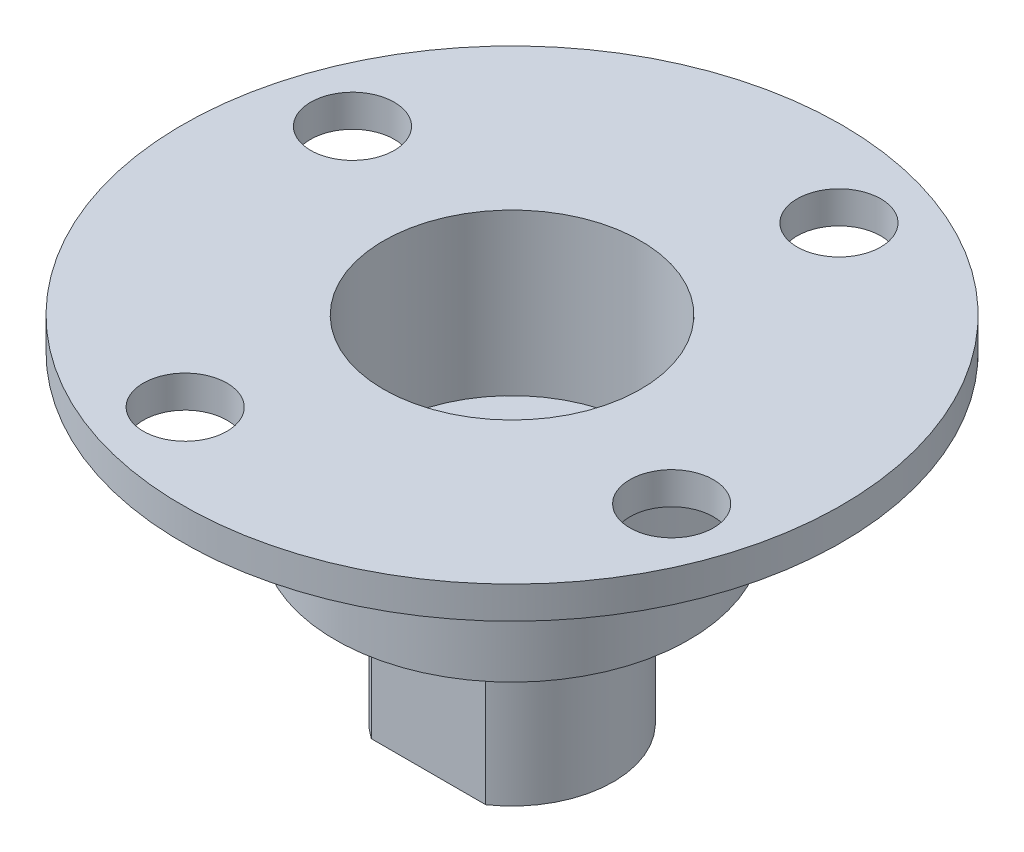
from build123d import *

# Parameters (mm, degrees)
ESQUISSE1_R                  = 10.25
BOSS_EXTRU_1_DEPTH           = 1
D_GAGEMENT_M21_D             = 2.6
R_P_TITION_CIRCULAIRE1_COUNT = 4
ESQUISSE9_R                  = 5.5
BOSS_EXTRU_4_DEPTH           = 5
CONG_1_R                     = 0.5
ESQUISSE11_R                 = 4
ENL_V_MAT_EXTRU_2_DEPTH      = 5
BOSS_EXTRU_5_DEPTH           = 5


with BuildPart() as part:
    # Esquisse1 → Boss.-Extru.1 (new body)
    with BuildSketch(Plane.XZ.offset(38.601290575)):
        with Locations(Location((14.017249305, 17.25, 0), (0, 0, 270))):
            Circle(ESQUISSE1_R)
    extrude(amount=BOSS_EXTRU_1_DEPTH)

    # Dégagement M21 (through all)
    with Locations(Plane(origin=(0, -39.601290575, 0), x_dir=(-1, 0, 0), z_dir=(0, -1, 0))):
        with Locations((-11.415520349, -24.815117741)):
            d_gagement_m21 = Hole(D_GAGEMENT_M21_D / 2)

    # Répétition circulaire1: Dégagement M21 ×4 about axis
    r_p_tition_circulaire1_axis = Axis((14.017249305, 0, 17.25), (0, 1, 0))
    for i in range(1, R_P_TITION_CIRCULAIRE1_COUNT):
        add(d_gagement_m21.rotate(r_p_tition_circulaire1_axis, i * 360 / R_P_TITION_CIRCULAIRE1_COUNT), mode=Mode.SUBTRACT)

    # Esquisse9 → Boss.-Extru.4 (add)
    with BuildSketch(Plane(origin=(0, -39.601290575, 0), x_dir=(-1, 0, 0), z_dir=(0, -1, 0))):
        with Locations(Location((-14.017249305, -17.25, 0), (0, 0, 90))):
            Circle(ESQUISSE9_R)
    extrude(amount=BOSS_EXTRU_4_DEPTH)

    # Congé1
    cong_1_edges = [part.edges().sort_by_distance(p)[0] for p in [
        (14.017249305, -39.601290575, 22.75),
    ]]
    fillet(cong_1_edges, radius=CONG_1_R)

    # Esquisse11 → Enlèv. mat.-Extru.2 (cut)
    with BuildSketch(Plane(origin=(0, -38.601290575, 0), x_dir=(1, 0, 0), z_dir=(0, 1, 0))):
        with Locations(Location((14.017249305, -17.25, 0), (0, 0, 270))):
            Circle(ESQUISSE11_R)
    extrude(amount=-ENL_V_MAT_EXTRU_2_DEPTH, mode=Mode.SUBTRACT)

    # Esquisse10 → Boss.-Extru.5 (add)
    with BuildSketch(Plane.XZ.offset(44.601290575)):
        with BuildLine():
            Line((12.238907381, 19.85), (15.79559123, 19.85))
            ThreePointArc((15.79559123, 19.85), (14.017249305, 14.1), (12.238907381, 19.85))
        make_face()
    extrude(amount=BOSS_EXTRU_5_DEPTH)


solid = part.part
